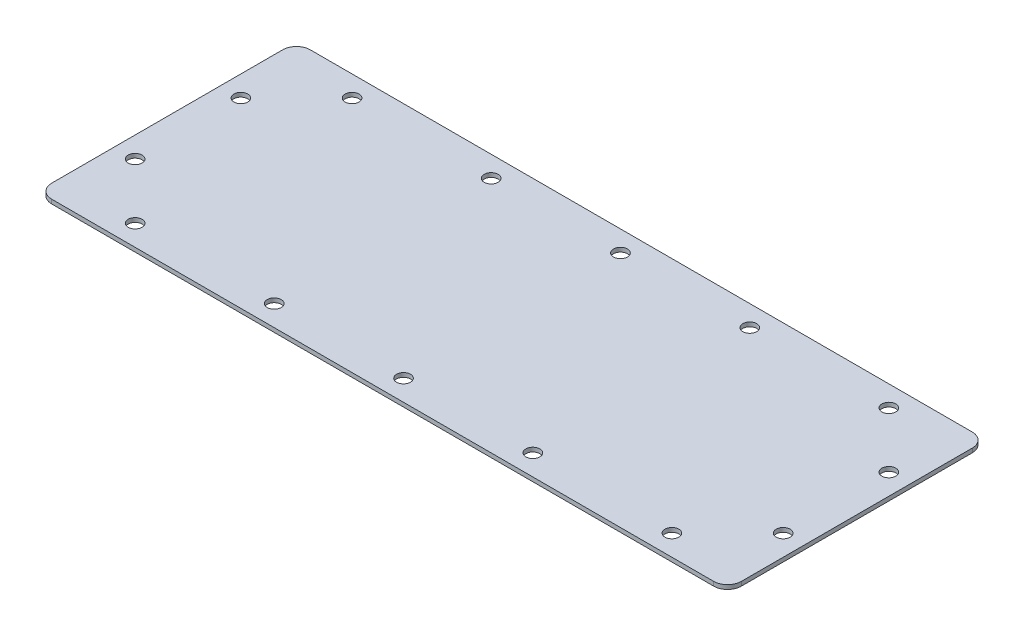
from build123d import *

# Parameters (mm, degrees)
SKETCH1_R           = 5
BOSS_EXTRUDE1_DEPTH = 3


with BuildPart() as part:
    # Sketch1 → Boss-Extrude1 (new body)
    with BuildSketch(Plane(origin=(0, 0, 0), x_dir=(1, 0, 0), z_dir=(0, 1, 0))):
        with BuildLine():
            Line((-238, 93), (238, 93))
            ThreePointArc((238, 93), (245.071067812, 90.071067812), (248, 83))
            Line((248, 83), (248, -83))
            ThreePointArc((248, -83), (245.071067812, -90.071067812), (238, -93))
            Line((238, -93), (-238, -93))
            ThreePointArc((-238, -93), (-245.071067812, -90.071067812), (-248, -83))
            Line((-248, -83), (-248, 83))
            ThreePointArc((-248, 83), (-245.071067812, 90.071067812), (-238, 93))
        make_face()
        with Locations(Location((-193, 78, 0), (0, 0, 270))):
            Circle(SKETCH1_R, mode=Mode.SUBTRACT)
        with Locations(Location((-93, 78, 0), (0, 0, 270))):
            Circle(SKETCH1_R, mode=Mode.SUBTRACT)
        with Locations(Location((0, 78, 0), (0, 0, 270))):
            Circle(SKETCH1_R, mode=Mode.SUBTRACT)
        with Locations(Location((-233, 38, 0), (0, 0, 270))):
            Circle(SKETCH1_R, mode=Mode.SUBTRACT)
        with Locations(Location((93, 78, 0), (0, 0, 270))):
            Circle(SKETCH1_R, mode=Mode.SUBTRACT)
        with Locations(Location((193, 78, 0), (0, 0, 270))):
            Circle(SKETCH1_R, mode=Mode.SUBTRACT)
        with Locations(Location((233, 38, 0), (0, 0, 270))):
            Circle(SKETCH1_R, mode=Mode.SUBTRACT)
        with Locations(Location((233, -38, 0), (0, 0, 90))):
            Circle(SKETCH1_R, mode=Mode.SUBTRACT)
        with Locations(Location((193, -78, 0), (0, 0, 90))):
            Circle(SKETCH1_R, mode=Mode.SUBTRACT)
        with Locations(Location((93, -78, 0), (0, 0, 90))):
            Circle(SKETCH1_R, mode=Mode.SUBTRACT)
        with Locations(Location((0, -78, 0), (0, 0, 90))):
            Circle(SKETCH1_R, mode=Mode.SUBTRACT)
        with Locations(Location((-93, -78, 0), (0, 0, 90))):
            Circle(SKETCH1_R, mode=Mode.SUBTRACT)
        with Locations(Location((-193, -78, 0), (0, 0, 90))):
            Circle(SKETCH1_R, mode=Mode.SUBTRACT)
        with Locations(Location((-233, -38, 0), (0, 0, 90))):
            Circle(SKETCH1_R, mode=Mode.SUBTRACT)
    extrude(amount=BOSS_EXTRUDE1_DEPTH)


solid = part.part
